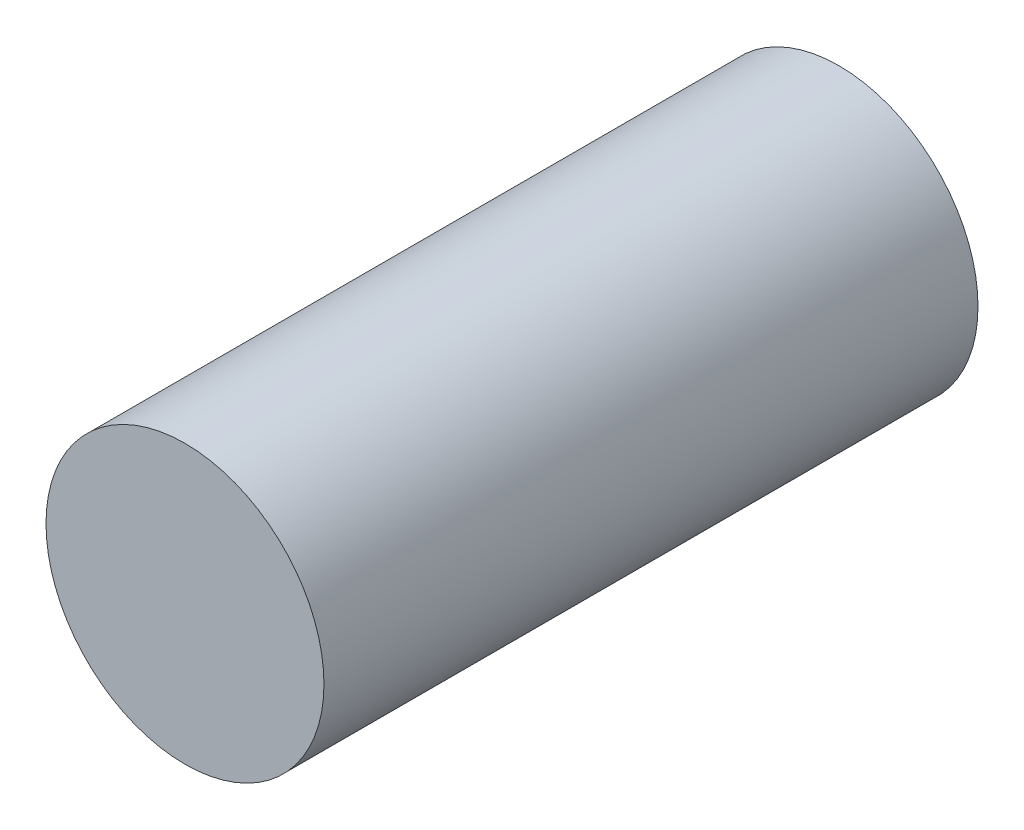
from build123d import *

# Parameters (mm, degrees)
SKETCH_1_R          = 8
EXTRUDE_1_DEPTH     = 24
SKETCH_2_R          = 42
EXTRUDE_2_DEPTH     = 18
SKETCH_4_OUTSIDE_W  = 110.238
SKETCH_4_OUTSIDE_H  = 110.238
SKETCH_4_OUTSIDE_R  = 5.1
CUT_EXTRUDE_2_DEPTH = 65.062469512


with BuildPart() as part:
    # 草图1 → 凸台-拉伸1 (new body)
    with BuildSketch(Plane.XY):
        Circle(SKETCH_1_R)
    extrude(amount=EXTRUDE_1_DEPTH)

    # 草图2 → 凸台-拉伸2 (add)
    with BuildSketch(Plane.XY):
        Circle(SKETCH_2_R)
    extrude(amount=EXTRUDE_2_DEPTH)

    # 草图4 outside → 切除-拉伸2 (cut, through all)
    with BuildSketch(Plane.XY.offset(24)):
        Rectangle(SKETCH_4_OUTSIDE_W, SKETCH_4_OUTSIDE_H)
        Circle(SKETCH_4_OUTSIDE_R, mode=Mode.SUBTRACT)
    extrude(amount=-CUT_EXTRUDE_2_DEPTH, mode=Mode.SUBTRACT)


solid = part.part
